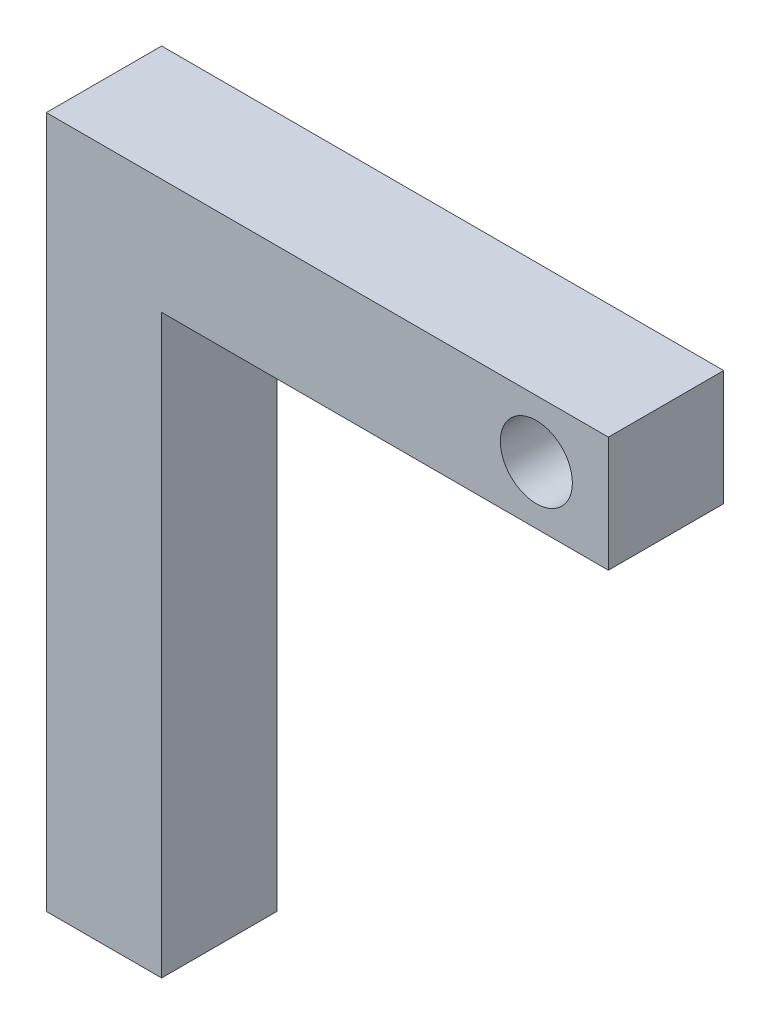
from build123d import *

# Parameters (mm, degrees)
BOSS_EXTRUDE1_DEPTH = 80
SKETCH2_R           = 25
CUT_EXTRUDE1_DEPTH  = 161


with BuildPart() as part:
    # Sketch1 → Boss-Extrude1 (new body)
    with BuildSketch(Plane.XY):
        Polygon((0, 0), (0, 480), (390, 480), (390, 400), (80, 400), (80, 0), align=None)
    extrude(amount=BOSS_EXTRUDE1_DEPTH)

    # Sketch2 → Cut-Extrude1 (cut)
    with BuildSketch(Plane.XY.offset(80)):
        with Locations((340, 440)):
            Circle(SKETCH2_R)
    extrude(amount=-CUT_EXTRUDE1_DEPTH, mode=Mode.SUBTRACT)


solid = part.part
